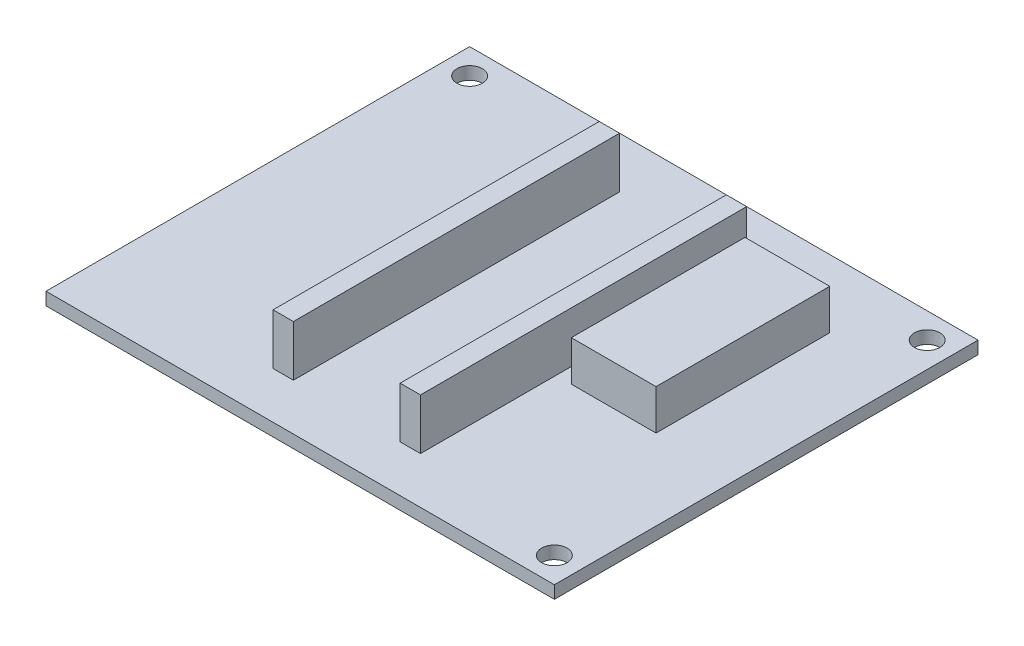
from build123d import *

# Parameters (mm, degrees)
SKETCH1_W                   = 60
SKETCH1_H                   = 50
SKETCH1_R                   = 1.5
PCB_DEPTH                   = 1.5
SKETCH2_W                   = 2.4
SKETCH2_H                   = 38.5
NANO_FEMALE_HEADERS_DEPTH   = 6
NANO_FEMALE_HEADERS_2_DEPTH = 6
SKETCH3_W                   = 10
SKETCH3_H                   = 20.5
DIP16_SOCKET_DEPTH          = 4.75


with BuildPart() as part:
    # Sketch1 → pcb (new body)
    with BuildSketch(Plane(origin=(0, 0, 0), x_dir=(1, 0, 0), z_dir=(0, 1, 0))):
        Rectangle(SKETCH1_W, SKETCH1_H)
        with Locations(Location((-27, 22, 0), (0, 0, 270))):
            Circle(SKETCH1_R, mode=Mode.SUBTRACT)
        with Locations(Location((27, 22, 0), (0, 0, 90))):
            Circle(SKETCH1_R, mode=Mode.SUBTRACT)
        with Locations(Location((27, -22, 0), (0, 0, 270))):
            Circle(SKETCH1_R, mode=Mode.SUBTRACT)
    extrude(amount=PCB_DEPTH)


with BuildPart() as body_2:
    # Sketch2 → nano_female_headers (new body)
    with BuildSketch(Plane(origin=(0, 1.5, 0), x_dir=(1, 0, 0), z_dir=(0, 1, 0))):
        with Locations((-7.5, -0.25)):
            Rectangle(SKETCH2_W, SKETCH2_H)
    extrude(amount=NANO_FEMALE_HEADERS_DEPTH)


with BuildPart() as body_3:
    # Sketch2 → nano_female_headers 2 (new body)
    with BuildSketch(Plane(origin=(0, 1.5, 0), x_dir=(1, 0, 0), z_dir=(0, 1, 0))):
        with Locations((7.5, -0.25)):
            Rectangle(SKETCH2_W, SKETCH2_H)
    extrude(amount=NANO_FEMALE_HEADERS_2_DEPTH)


with BuildPart() as body_4:
    # Sketch3 → dip16_socket (new body)
    with BuildSketch(Plane(origin=(0, 1.5, 0), x_dir=(1, 0, 0), z_dir=(0, 1, 0))):
        with Locations((15.5, 6.75)):
            Rectangle(SKETCH3_W, SKETCH3_H)
    extrude(amount=DIP16_SOCKET_DEPTH)


solid = Compound([part.part, body_2.part, body_3.part, body_4.part])
